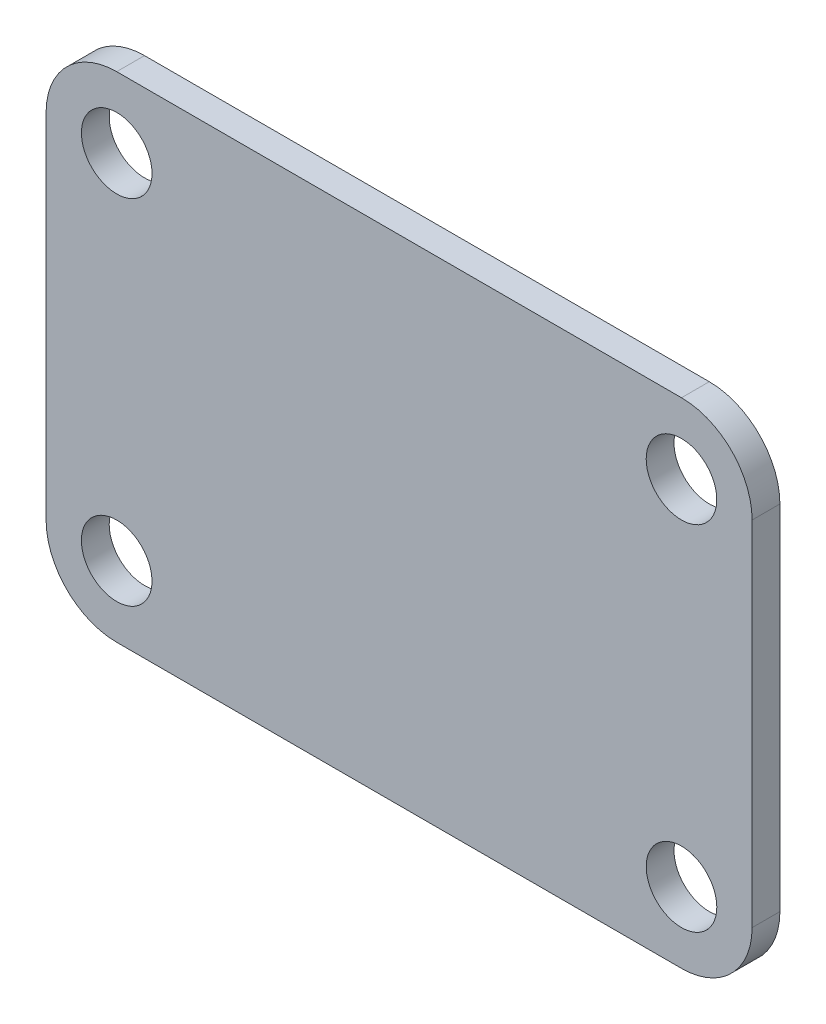
from build123d import *

# Parameters (mm, degrees)
CROQUIS1_R              = 1.27
SALIENTE_EXTRUIR1_DEPTH = 1


with BuildPart() as part:
    # Croquis1 → Saliente-Extruir1 (new body)
    with BuildSketch(Plane.XY):
        with BuildLine():
            Line((10.16, -8.89), (-10.16, -8.89))
            ThreePointArc((-10.16, -8.89), (-11.956051224, -8.146051224), (-12.7, -6.35))
            Line((-12.7, -6.35), (-12.7, 6.35))
            ThreePointArc((-12.7, 6.35), (-11.956051224, 8.146051224), (-10.16, 8.89))
            Line((-10.16, 8.89), (10.16, 8.89))
            ThreePointArc((10.16, 8.89), (11.956051224, 8.146051224), (12.7, 6.35))
            Line((12.7, 6.35), (12.7, -6.35))
            ThreePointArc((12.7, -6.35), (11.956051224, -8.146051224), (10.16, -8.89))
        make_face()
        with Locations((-10.16, 6.35)):
            Circle(CROQUIS1_R, mode=Mode.SUBTRACT)
        with Locations(Location((10.16, 6.35, 0), (0, 0, 180))):
            Circle(CROQUIS1_R, mode=Mode.SUBTRACT)
        with Locations((10.16, -6.35)):
            Circle(CROQUIS1_R, mode=Mode.SUBTRACT)
        with Locations(Location((-10.16, -6.35, 0), (0, 0, 180))):
            Circle(CROQUIS1_R, mode=Mode.SUBTRACT)
    extrude(amount=SALIENTE_EXTRUIR1_DEPTH)


solid = part.part
